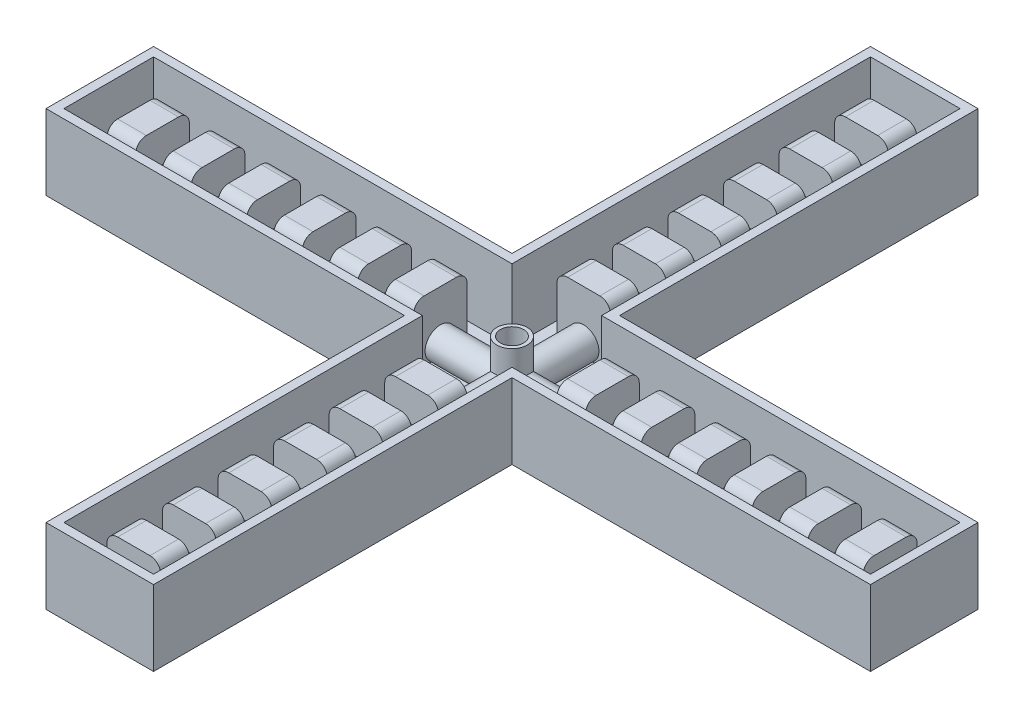
from build123d import *

# Parameters (mm, degrees)
SKETCH_1_W                        = 100
SKETCH_1_H                        = 30
EXTRUDE_2_DEPTH                   = 1
EXTRUDE_5_DEPTH                   = 20
SKETCH_3_W                        = 8
SKETCH_3_H                        = 15
EXTRUDE_6_DEPTH                   = 17
FILLET_1_R                        = 3
EXTRUDE_7_REACH                   = 100.443
SKETCH_1_4_W                      = 30
SKETCH_1_4_H                      = 30
EXTRUDE_11_DEPTH                  = 1
SKETCH_7_R                        = 4.25
SKETCH_7_R_2                      = 3.25
EXTRUDE_12_DEPTH                  = 15
SKETCH_9_W                        = 2.5
SKETCH_9_H                        = 2.5
EXTRUDE_13_DEPTH                  = 20
PATTERN_CIRCULAR_21_COUNT         = 4
FILLET_1_OF_PATTERN_CIRCULAR_21_R = 3
PATTERN_CIRCULAR_22_COUNT         = 2
EXTRUDE_START                     = 125.5
EXTRUDE_14_DEPTH                  = 125.5
EXTRUDE_15_DEPTH                  = 20
EXTRUDE_16_REACH                  = 180.581
EXTRUDE_16_DIRECTION_2_REACH      = 180.581
CUT_EXTRUDE_START                 = -15
SKETCH_8_R                        = 3.25
CUT_EXTRUDE_4_DEPTH               = 15


with BuildPart() as part:
    # 草图1 → 凸台-拉伸2 (new body)
    with BuildSketch(Plane(origin=(0, 0, 0), x_dir=(1, 0, 0), z_dir=(0, 1, 0))):
        with Locations((65, 0)):
            Rectangle(SKETCH_1_W, SKETCH_1_H)
    extrude_2 = extrude(amount=EXTRUDE_2_DEPTH)

    # 草图2 → 凸台-拉伸5 (add)
    with BuildSketch(Plane(origin=(0, 1, 0), x_dir=(1, 0, 0), z_dir=(0, 1, 0))):
        Polygon((15, 15), (15, 12.5), (112.5, 12.5), (112.5, -12.5), (15, -12.5), (15, -15), (115, -15), (115, 15), align=None)
    extrude_5 = extrude(amount=EXTRUDE_5_DEPTH)

    # 草图3 → 凸台-拉伸6 (add)
    with BuildSketch(Plane(origin=(0, 1, 0), x_dir=(1, 0, 0), z_dir=(0, 1, 0))):
        with Locations((101.5, 0)):
            Rectangle(SKETCH_3_W, SKETCH_3_H)
        with Locations((86, 0)):
            Rectangle(SKETCH_3_W, SKETCH_3_H)
        with Locations((70.5, 0)):
            Rectangle(SKETCH_3_W, SKETCH_3_H)
        with Locations((55, 0)):
            Rectangle(SKETCH_3_W, SKETCH_3_H)
        with Locations((39.5, 0)):
            Rectangle(SKETCH_3_W, SKETCH_3_H)
        with Locations((24, 0)):
            Rectangle(SKETCH_3_W, SKETCH_3_H)
    extrude_6 = extrude(amount=EXTRUDE_6_DEPTH)

    # 圆角1
    fillet_1_edges = [part.edges().sort_by_distance(p)[0] for p in [
        (101.5, 18, -7.5),
        (101.5, 18, 7.5),
        (86, 18, -7.5),
        (86, 18, 7.5),
        (70.5, 18, -7.5),
        (70.5, 18, 7.5),
        (55, 18, -7.5),
        (55, 18, 7.5),
        (39.5, 18, -7.5),
        (39.5, 18, 7.5),
        (24, 18, -7.5),
        (24, 18, 7.5),
    ]]
    fillet(fillet_1_edges, radius=FILLET_1_R)

    # 凸台-拉伸7: up to this face of the body (flat: up to its plane)
    extrude_7_end = Plane(part.part.faces().sort_by_distance((105.5, 9.379565489, 0))[0])
    # 草图4 → 凸台-拉伸7 (add, up to the picked face)
    with BuildSketch(Plane.ZY.offset(-20), mode=Mode.PRIVATE) as extrude_7_sk1:
        with BuildLine():
            ThreePointArc((4.25, 4.5), (-1.976881517, 8.262238624), (-2.41091269, 1))
            Line((-2.41091269, 1), (2.41091269, 1))
            ThreePointArc((2.41091269, 1), (3.762238624, 2.523118483), (4.25, 4.5))
        make_face()
    extrude_7_tool1 = split(extrude(extrude_7_sk1.sketch, amount=-EXTRUDE_7_REACH, mode=Mode.PRIVATE), bisect_by=extrude_7_end, keep=Keep.BOTH, mode=Mode.PRIVATE)
    # 草图4 → 凸台-拉伸7 (add, up to the picked face)
    with BuildSketch(Plane.ZY.offset(-20), mode=Mode.PRIVATE) as extrude_7_sk2:
        with BuildLine():
            Line((2.41091269, 1), (-2.41091269, 1))
            ThreePointArc((-2.41091269, 1), (0, 0.25), (2.41091269, 1))
        make_face()
    extrude_7_tool2 = split(extrude(extrude_7_sk2.sketch, amount=-EXTRUDE_7_REACH, mode=Mode.PRIVATE), bisect_by=extrude_7_end, keep=Keep.BOTH, mode=Mode.PRIVATE)
    add(extrude_7_tool1.solids().sort_by(Axis((20, 4.672087, 0), (1, 0, 0)))[0])
    add(extrude_7_tool2.solids().sort_by(Axis((20, 0.697609, 0), (1, 0, 0)))[0])

    # 草图1<4> → 凸台-拉伸11 (add)
    with BuildSketch(Plane(origin=(0, 0, 0), x_dir=(1, 0, 0), z_dir=(0, 1, 0))):
        Rectangle(SKETCH_1_4_W, SKETCH_1_4_H)
    extrude(amount=EXTRUDE_11_DEPTH)

    # 草图7 → 凸台-拉伸12 (add)
    with BuildSketch(Plane(origin=(0, 1, 0), x_dir=(1, 0, 0), z_dir=(0, 1, 0))):
        with Locations(Location((0, 0, 0), (0, 0, 270))):
            Circle(SKETCH_7_R)
        with Locations(Location((0, 0, 0), (0, 0, 270))):
            Circle(SKETCH_7_R_2, mode=Mode.SUBTRACT)
    extrude(amount=EXTRUDE_12_DEPTH)

    # 草图9 → 凸台-拉伸13 (add)
    with BuildSketch(Plane(origin=(0, 1, 0), x_dir=(1, 0, 0), z_dir=(0, 1, 0))):
        with Locations((13.75, 13.75)):
            Rectangle(SKETCH_9_W, SKETCH_9_H)
        with Locations((13.75, -13.75)):
            Rectangle(SKETCH_9_W, SKETCH_9_H)
    extrude_13 = extrude(amount=EXTRUDE_13_DEPTH)

    # 阵列(圆周)21: 凸台-拉伸2, 凸台-拉伸6 ×4 about axis
    pattern_circular_21_axis = Axis((0, 0, 0), (0, 1, 0))
    add([extrude_2.rotate(pattern_circular_21_axis, i * 360 / PATTERN_CIRCULAR_21_COUNT) for i in range(1, PATTERN_CIRCULAR_21_COUNT)])
    add([extrude_6.rotate(pattern_circular_21_axis, i * 360 / PATTERN_CIRCULAR_21_COUNT) for i in range(1, PATTERN_CIRCULAR_21_COUNT)])

    # 圆角1 of 阵列(圆周)21
    fillet_1_of_pattern_circular_21_edges = [part.edges().sort_by_distance(p)[0] for p in [
        (-7.5, 18, -101.5),
        (7.5, 18, -101.5),
        (-7.5, 18, -86),
        (7.5, 18, -86),
        (-7.5, 18, -70.5),
        (7.5, 18, -70.5),
        (-7.5, 18, -55),
        (7.5, 18, -55),
        (-7.5, 18, -39.5),
        (7.5, 18, -39.5),
        (-7.5, 18, -24),
        (7.5, 18, -24),
        (-101.5, 18, 7.5),
        (-101.5, 18, -7.5),
        (-86, 18, 7.5),
        (-86, 18, -7.5),
        (-70.5, 18, 7.5),
        (-70.5, 18, -7.5),
        (-55, 18, 7.5),
        (-55, 18, -7.5),
        (-39.5, 18, 7.5),
        (-39.5, 18, -7.5),
        (-24, 18, 7.5),
        (-24, 18, -7.5),
        (7.5, 18, 101.5),
        (-7.5, 18, 101.5),
        (7.5, 18, 86),
        (-7.5, 18, 86),
        (7.5, 18, 70.5),
        (-7.5, 18, 70.5),
        (7.5, 18, 55),
        (-7.5, 18, 55),
        (7.5, 18, 39.5),
        (-7.5, 18, 39.5),
        (7.5, 18, 24),
        (-7.5, 18, 24),
    ]]
    fillet(fillet_1_of_pattern_circular_21_edges, radius=FILLET_1_OF_PATTERN_CIRCULAR_21_R)

    # 阵列(圆周)22: 凸台-拉伸5, 凸台-拉伸13 ×2 about axis
    pattern_circular_22_axis = Axis((0, 0, 0), (0, 1, 0))
    add([extrude_5.rotate(pattern_circular_22_axis, i * 360 / PATTERN_CIRCULAR_22_COUNT) for i in range(1, PATTERN_CIRCULAR_22_COUNT)])
    add([extrude_13.rotate(pattern_circular_22_axis, i * 360 / PATTERN_CIRCULAR_22_COUNT) for i in range(1, PATTERN_CIRCULAR_22_COUNT)])

    # 草图4<6> → 凸台-拉伸14 (add)
    with BuildSketch(Plane.ZY.offset(-20).offset(EXTRUDE_START)):
        with BuildLine():
            ThreePointArc((4.25, 4.5), (-1.976881517, 8.262238624), (-2.41091269, 1))
            Line((-2.41091269, 1), (2.41091269, 1))
            ThreePointArc((2.41091269, 1), (3.762238624, 2.523118483), (4.25, 4.5))
        make_face()
        with BuildLine():
            Line((2.41091269, 1), (-2.41091269, 1))
            ThreePointArc((-2.41091269, 1), (0, 0.25), (2.41091269, 1))
        make_face()
    extrude(amount=-EXTRUDE_14_DEPTH)

    # 草图11 → 凸台-拉伸15 (add)
    with BuildSketch(Plane(origin=(0, 1, 0), x_dir=(1, 0, 0), z_dir=(0, 1, 0))):
        Polygon((-12.5, 112.5), (12.5, 112.5), (12.5, 15), (15, 15), (15, 115), (-15, 115), (-15, 15), (-12.5, 15), align=None)
        Polygon((15, -15), (12.5, -15), (12.5, -112.5), (-12.5, -112.5), (-12.5, -15), (-15, -15), (-15, -115), (15, -115), align=None)
    extrude(amount=EXTRUDE_15_DEPTH)

    # 凸台-拉伸16: up to this face of the body (flat: up to its plane)
    extrude_16_end = Plane(part.part.faces().sort_by_distance((0, 9.379565489, 105.5))[0])
    # 草图12 → 凸台-拉伸16 (add, up to the picked face)
    with BuildSketch(Plane.XY.offset(-20), mode=Mode.PRIVATE) as extrude_16_sk1:
        with BuildLine():
            ThreePointArc((4.25, 4.5), (-1.976881517, 8.262238624), (-2.41091269, 1))
            Line((-2.41091269, 1), (2.41091269, 1))
            ThreePointArc((2.41091269, 1), (3.762238624, 2.523118483), (4.25, 4.5))
        make_face()
    extrude_16_tool1 = split(extrude(extrude_16_sk1.sketch, amount=EXTRUDE_16_REACH, mode=Mode.PRIVATE), bisect_by=extrude_16_end, keep=Keep.BOTH, mode=Mode.PRIVATE)
    # 草图12 → 凸台-拉伸16 (add, up to the picked face)
    with BuildSketch(Plane.XY.offset(-20), mode=Mode.PRIVATE) as extrude_16_sk2:
        with BuildLine():
            Line((2.41091269, 1), (-2.41091269, 1))
            ThreePointArc((-2.41091269, 1), (0, 0.25), (2.41091269, 1))
        make_face()
    extrude_16_tool2 = split(extrude(extrude_16_sk2.sketch, amount=EXTRUDE_16_REACH, mode=Mode.PRIVATE), bisect_by=extrude_16_end, keep=Keep.BOTH, mode=Mode.PRIVATE)
    add(extrude_16_tool1.solids().sort_by(Axis((0, 4.672087, -20), (0, 0, 1)))[0])
    add(extrude_16_tool2.solids().sort_by(Axis((0, 0.697609, -20), (0, 0, 1)))[0])

    # 凸台-拉伸16 direction 2: up to this face of the body (flat: up to its plane)
    extrude_16_direction_2_end = Plane(part.part.faces().sort_by_distance((0, 9.379565489, -105.5))[0])
    # 草图12 → 凸台-拉伸16 direction 2 (add, up to the picked face)
    with BuildSketch(Plane.XY.offset(-20), mode=Mode.PRIVATE) as extrude_16_direction_2_sk1:
        with BuildLine():
            ThreePointArc((4.25, 4.5), (-1.976881517, 8.262238624), (-2.41091269, 1))
            Line((-2.41091269, 1), (2.41091269, 1))
            ThreePointArc((2.41091269, 1), (3.762238624, 2.523118483), (4.25, 4.5))
        make_face()
    extrude_16_direction_2_tool1 = split(extrude(extrude_16_direction_2_sk1.sketch, amount=-EXTRUDE_16_DIRECTION_2_REACH, mode=Mode.PRIVATE), bisect_by=extrude_16_direction_2_end, keep=Keep.BOTH, mode=Mode.PRIVATE)
    # 草图12 → 凸台-拉伸16 direction 2 (add, up to the picked face)
    with BuildSketch(Plane.XY.offset(-20), mode=Mode.PRIVATE) as extrude_16_direction_2_sk2:
        with BuildLine():
            Line((2.41091269, 1), (-2.41091269, 1))
            ThreePointArc((-2.41091269, 1), (0, 0.25), (2.41091269, 1))
        make_face()
    extrude_16_direction_2_tool2 = split(extrude(extrude_16_direction_2_sk2.sketch, amount=-EXTRUDE_16_DIRECTION_2_REACH, mode=Mode.PRIVATE), bisect_by=extrude_16_direction_2_end, keep=Keep.BOTH, mode=Mode.PRIVATE)
    add(extrude_16_direction_2_tool1.solids().sort_by(Axis((0, 4.672087, -20), (0, 0, -1)))[0])
    add(extrude_16_direction_2_tool2.solids().sort_by(Axis((0, 0.697609, -20), (0, 0, -1)))[0])

    # 草图8 → 切除-拉伸4 (cut)
    with BuildSketch(Plane(origin=(0, 16, 0), x_dir=(1, 0, 0), z_dir=(0, 1, 0)).offset(CUT_EXTRUDE_START)):
        with Locations(Location((0, 0, 0), (0, 0, 270))):
            Circle(SKETCH_8_R)
    extrude(amount=CUT_EXTRUDE_4_DEPTH, mode=Mode.SUBTRACT)


solid = part.part
